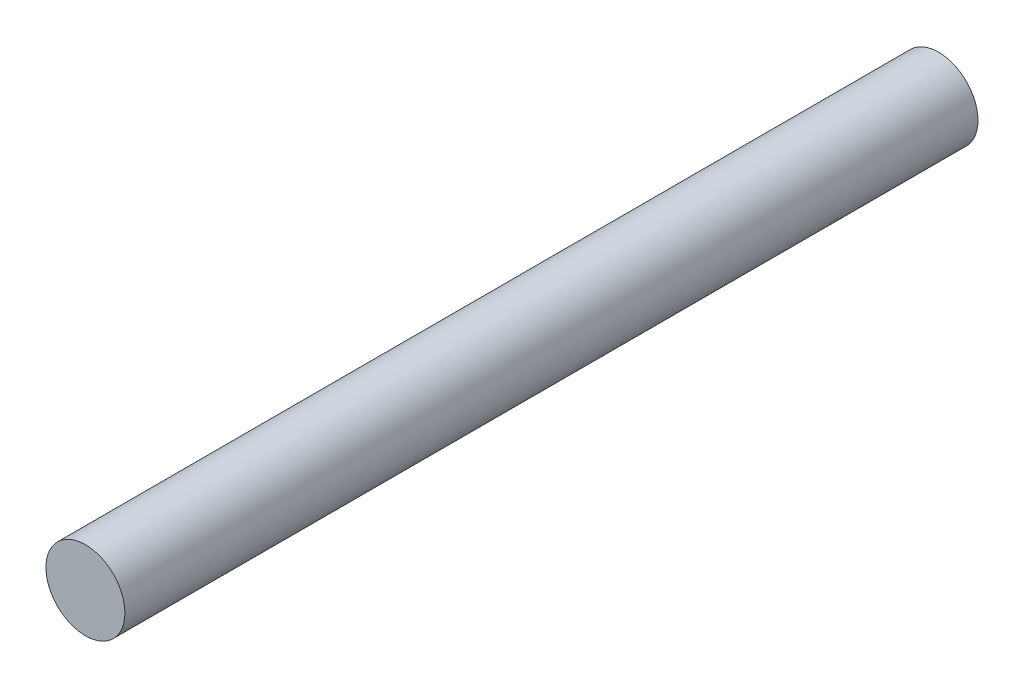
from build123d import *

# Parameters (mm, degrees)
SKETCH1_R           = 2.5
BOSS_EXTRUDE1_DEPTH = 54


with BuildPart() as part:
    # Sketch1 → Boss-Extrude1 (new body)
    with BuildSketch(Plane.XY):
        Circle(SKETCH1_R)
    extrude(amount=BOSS_EXTRUDE1_DEPTH)


solid = part.part
